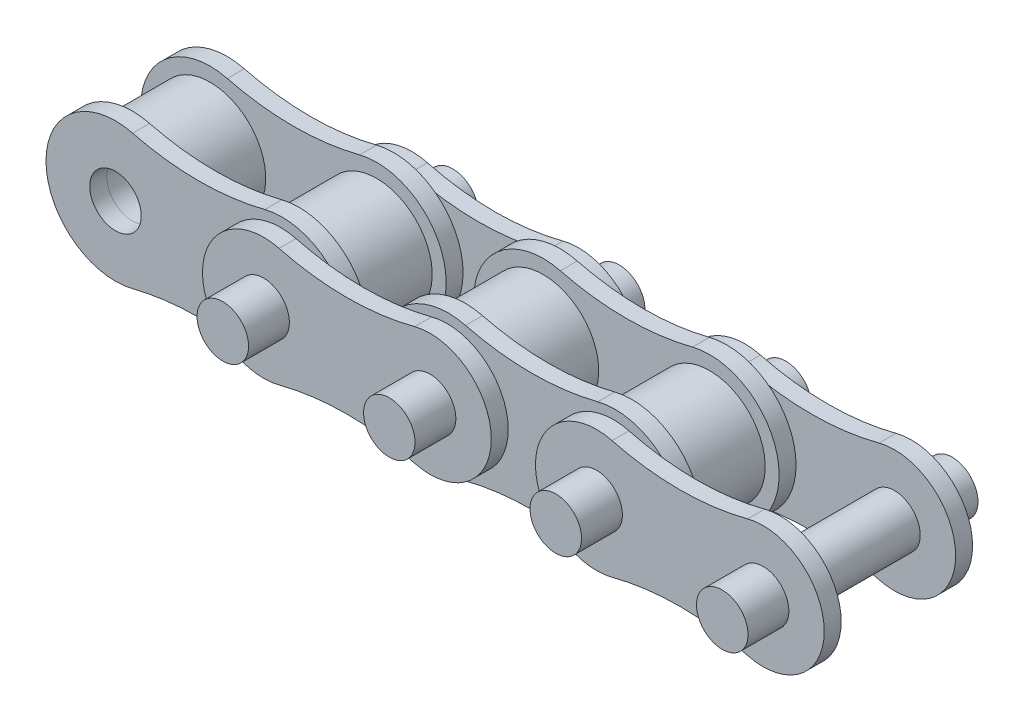
from build123d import *

# Parameters (mm, degrees)
SKETCH4_R                  = 2
SKETCH4_R_2                = 0.9525
BOSS_EXTRUDE1_DEPTH        = 1.4
BOSS_EXTRUDE1_2_DEPTH      = 1.4
SKETCH5_R                  = 0.9271
BOSS_EXTRUDE2_DEPTH        = 0.6096
LPATTERN1_COUNT            = 2
LPATTERN1_PITCH            = 5.9944
SKETCH7_R                  = 0.9271
BOSS_EXTRUDE3_DEPTH        = 0.6096
BOSS_EXTRUDE4_DEPTH        = 4.1402
BOSS_EXTRUDE4_DEPTH_BACK   = 4.1402
SKETCH8_R                  = 0.9271
BOSS_EXTRUDE4_2_DEPTH      = 4.1402
BOSS_EXTRUDE4_2_DEPTH_BACK = 4.1402
LPATTERN2_COUNT            = 2
LPATTERN2_PITCH            = 11.9888


with BuildPart() as part:
    # Sketch4 → Boss-Extrude1 (new, symmetric)
    with BuildSketch(Plane.XY):
        with Locations((-2.9972, 0)):
            Circle(SKETCH4_R)
        with Locations((-2.9972, 0)):
            Circle(SKETCH4_R_2, mode=Mode.SUBTRACT)
    extrude(amount=BOSS_EXTRUDE1_DEPTH, both=True)


with BuildPart() as body_2:
    # Sketch4 → Boss-Extrude1 2 (new, symmetric)
    with BuildSketch(Plane.XY):
        with Locations((2.9972, 0)):
            Circle(SKETCH4_R)
        with Locations((2.9972, 0)):
            Circle(SKETCH4_R_2, mode=Mode.SUBTRACT)
    extrude(amount=BOSS_EXTRUDE1_2_DEPTH, both=True)


with BuildPart() as body_3:
    # Sketch5 → Boss-Extrude2 (new body)
    with BuildSketch(Plane.XY.offset(1.4)):
        with BuildLine():
            ThreePointArc((-2.380336072, 2.424661318), (-5.4991, 0), (-2.380336072, -2.424661318))
            ThreePointArc((-2.380336072, -2.424661318), (0, -2.126615), (2.380336072, -2.424661318))
            ThreePointArc((2.380336072, -2.424661318), (5.4991, 0), (2.380336072, 2.424661318))
            ThreePointArc((2.380336072, 2.424661318), (0, 2.126615), (-2.380336072, 2.424661318))
        make_face()
        with Locations((-2.9972, 0)):
            Circle(SKETCH5_R, mode=Mode.SUBTRACT)
        with Locations((2.9972, 0)):
            Circle(SKETCH5_R, mode=Mode.SUBTRACT)
    extrude(amount=BOSS_EXTRUDE2_DEPTH)


with BuildPart() as lpattern1_1:
    # LPattern1: pattern copy
    add(body_2.part.moved(Location(Vector(1, 0, 0) * (1 * LPATTERN1_PITCH))))


with BuildPart() as body_5:
    # Sketch7 → Boss-Extrude3 (new body)
    with BuildSketch(Plane.XY.offset(-2.0604)):
        with BuildLine():
            ThreePointArc((3.553786614, 2.130157491), (0.795528, 0), (3.553786614, -2.130157491))
            ThreePointArc((3.553786614, -2.130157491), (5.9944, -1.816568799), (8.435013386, -2.130157491))
            ThreePointArc((8.435013386, -2.130157491), (11.193272, 0), (8.435013386, 2.130157491))
            ThreePointArc((8.435013386, 2.130157491), (5.9944, 1.816568799), (3.553786614, 2.130157491))
        make_face()
        with Locations((2.9972, 0)):
            Circle(SKETCH7_R, mode=Mode.SUBTRACT)
        with Locations((8.9916, 0)):
            Circle(SKETCH7_R, mode=Mode.SUBTRACT)
    extrude(amount=-BOSS_EXTRUDE3_DEPTH)


with BuildPart() as body_6:
    # Mirror1: mirrored copy
    add(body_3.part.mirror(Plane.XY))


with BuildPart() as body_7:
    # Mirror1 2: mirrored copy
    add(body_5.part.mirror(Plane.XY))


with BuildPart() as body_8:
    # Sketch8 → Boss-Extrude4 (new, two sides: drawn at the far end of the back side and taken through both)
    with BuildSketch(Plane.XY.offset(-BOSS_EXTRUDE4_DEPTH_BACK)):
        with Locations((2.9972, 0)):
            Circle(SKETCH8_R)
    extrude(amount=BOSS_EXTRUDE4_DEPTH + BOSS_EXTRUDE4_DEPTH_BACK)


with BuildPart() as body_9:
    # Sketch8 → Boss-Extrude4 2 (new, two sides: drawn at the far end of the back side and taken through both)
    with BuildSketch(Plane.XY.offset(-BOSS_EXTRUDE4_2_DEPTH_BACK)):
        with Locations((8.9916, 0)):
            Circle(SKETCH8_R)
    extrude(amount=BOSS_EXTRUDE4_2_DEPTH + BOSS_EXTRUDE4_2_DEPTH_BACK)


with BuildPart() as lpattern2_1:
    # LPattern2: pattern copy
    add(body_9.part.moved(Location(Vector(1, 0, 0) * (1 * LPATTERN2_PITCH))))


with BuildPart() as lpattern2_2:
    # LPattern2: pattern copy
    add(body_8.part.moved(Location(Vector(1, 0, 0) * (1 * LPATTERN2_PITCH))))


with BuildPart() as lpattern2_3:
    # LPattern2: pattern copy
    add(body_7.part.moved(Location(Vector(1, 0, 0) * (1 * LPATTERN2_PITCH))))


with BuildPart() as lpattern2_4:
    # LPattern2: pattern copy
    add(body_6.part.moved(Location(Vector(1, 0, 0) * (1 * LPATTERN2_PITCH))))


with BuildPart() as lpattern2_5:
    # LPattern2: pattern copy
    add(body_5.part.moved(Location(Vector(1, 0, 0) * (1 * LPATTERN2_PITCH))))


with BuildPart() as lpattern2_6:
    # LPattern2: pattern copy
    add(lpattern1_1.part.moved(Location(Vector(1, 0, 0) * (1 * LPATTERN2_PITCH))))


with BuildPart() as lpattern2_7:
    # LPattern2: pattern copy
    add(body_3.part.moved(Location(Vector(1, 0, 0) * (1 * LPATTERN2_PITCH))))


with BuildPart() as lpattern2_8:
    # LPattern2: pattern copy
    add(body_2.part.moved(Location(Vector(1, 0, 0) * (1 * LPATTERN2_PITCH))))


with BuildPart() as lpattern2_9:
    # LPattern2: pattern copy
    add(part.part.moved(Location(Vector(1, 0, 0) * (1 * LPATTERN2_PITCH))))


with BuildPart() as body_2_1:
    add(body_2.part)

    # Combine1: union body 3, LPattern1_1, body 5, body 6, body 7, body 8, body 9, LPattern2_1, LPattern2_2, LPattern2_3, LPattern2_4, LPattern2_5, LPattern2_7, LPattern2_8, LPattern2_9, part
    add(body_3.part)
    add(lpattern1_1.part)
    add(body_5.part)
    add(body_6.part)
    add(body_7.part)
    add(body_8.part)
    add(body_9.part)
    add(lpattern2_1.part)
    add(lpattern2_2.part)
    add(lpattern2_3.part)
    add(lpattern2_4.part)
    add(lpattern2_5.part)
    add(lpattern2_7.part)
    add(lpattern2_8.part)
    add(lpattern2_9.part)
    add(part.part)


solid = body_2_1.part
